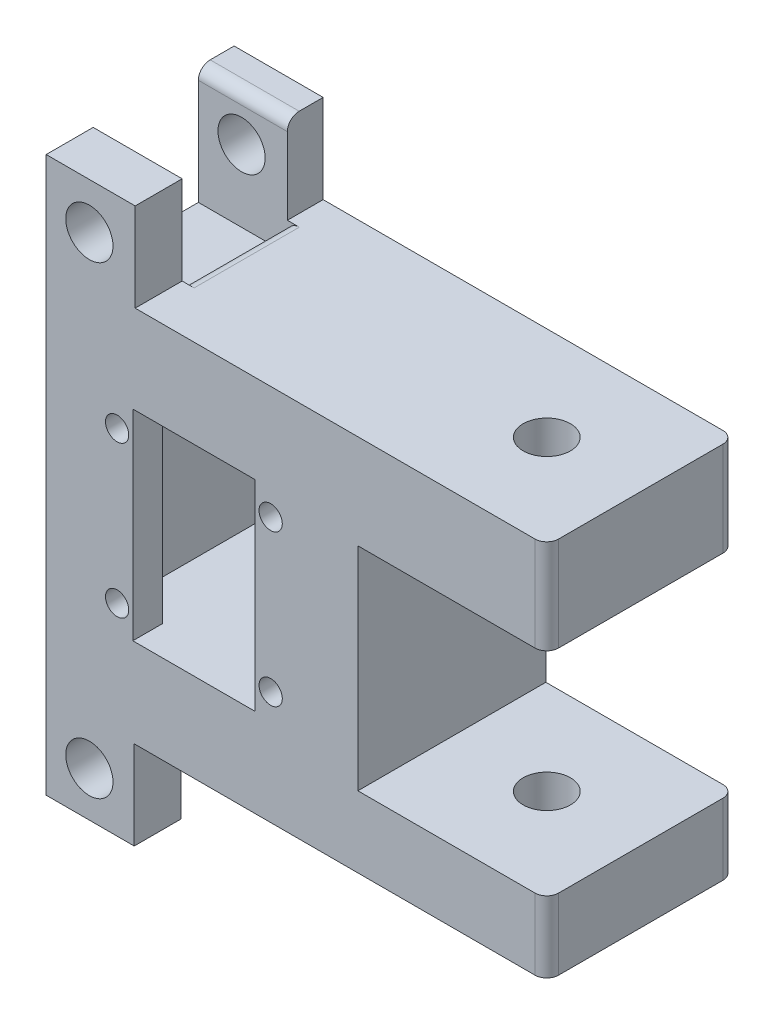
from build123d import *

# Parameters (mm, degrees)
BOSS_EXTRUDE1_DEPTH      = 55.88
BOSS_EXTRUDE1_DEPTH_BACK = 25.384918905
SKETCH1_W                = 107.698417182
SKETCH1_H                = 40.435670154
SKETCH7_W                = 43.633869471
SKETCH7_H                = 43.18
CUT_EXTRUDE8_DEPTH       = 88.506314553
SKETCH11_R               = 5.08
CUT_EXTRUDE9_DEPTH       = 100.561464261
FILLET2_R                = 2.54
SKETCH13_W               = 44.238094174
SKETCH13_H               = 45.644522424
CUT_EXTRUDE12_DEPTH      = 88.506314553
SKETCH16_W               = 19.145212778
SKETCH16_H               = 40.435670154
BOSS_EXTRUDE3_DEPTH      = 19.05
SKETCH17_W               = 18.93986558
SKETCH17_H               = 40.435670154
BOSS_EXTRUDE4_DEPTH      = 19.05
SKETCH18_R               = 5.08
CUT_EXTRUDE14_DEPTH      = 101.743662762
SKETCH19_W               = 12.523537134
SKETCH19_H               = 13.59850093
SKETCH19_W_2             = 10.108917538
SKETCH19_H_2             = 12.59254748
CUT_EXTRUDE15_DEPTH      = 19.05
SKETCH20_W               = 18.93986558
SKETCH20_H               = 22.510158117
CUT_EXTRUDE16_DEPTH      = 12.7
SKETCH23_W               = 22.632454672
SKETCH23_H               = 12.59254748
CUT_EXTRUDE19_DEPTH      = 12.7
SKETCH24_W               = 19.174620912
SKETCH24_H               = 22.632454672
CUT_EXTRUDE20_DEPTH      = 12.7
FILLET4_R                = 2.54
FILLET5_R                = 2.54
SKETCH25_W               = 8.617694519
SKETCH25_H               = 43.18
BOSS_EXTRUDE5_DEPTH      = 6.35
SKETCH26_W               = 8.674470407
SKETCH26_H               = 43.18
BOSS_EXTRUDE6_DEPTH      = 6.35
SKETCH27_R               = 2.5
CUT_EXTRUDE21_DEPTH      = 6.35
SKETCH22_W               = 22.632454672
SKETCH22_H               = 12.59254748
CUT_EXTRUDE18_DEPTH      = 12.7


with BuildPart() as part:
    # Sketch1 → Boss-Extrude1 (new, two sides: drawn at the far end of the back side and taken through both)
    with BuildSketch(Plane(origin=(0, 0, 0), x_dir=(1, 0, 0), z_dir=(0, 1, 0)).offset(-BOSS_EXTRUDE1_DEPTH_BACK)):
        Rectangle(SKETCH1_W, SKETCH1_H)
    extrude(amount=BOSS_EXTRUDE1_DEPTH + BOSS_EXTRUDE1_DEPTH_BACK)

    # Sketch7 → Cut-Extrude8 (cut, through all)
    with BuildSketch(Plane.XY.offset(20.217835077)):
        with Locations((-22.071539031, 15.247540547)):
            Rectangle(SKETCH7_W, SKETCH7_H)
    extrude(amount=-CUT_EXTRUDE8_DEPTH, mode=Mode.SUBTRACT)

    # Sketch11 → Cut-Extrude9 (cut, through all)
    with BuildSketch(Plane(origin=(0, -25.384918905, 0), x_dir=(-1, 0, 0), z_dir=(0, -1, 0))):
        with Locations(Location((-33.631373514, 0, 0), (0, 0, 90))):
            Circle(SKETCH11_R)
    extrude(amount=-CUT_EXTRUDE9_DEPTH, mode=Mode.SUBTRACT)

    # Fillet2
    fillet2_edges = [part.edges().sort_by_distance(p)[0] for p in [
        (53.849208591, 15.247540547, 20.217835077),
        (53.849208591, 15.247540547, -20.217835077),
    ]]
    fillet(fillet2_edges, radius=FILLET2_R)

    # Sketch13 → Cut-Extrude12 (cut, through all)
    with BuildSketch(Plane.XY.offset(20.217835077)):
        with Locations((35.328255678, 12.741509062)):
            Rectangle(SKETCH13_W, SKETCH13_H)
    extrude(amount=-CUT_EXTRUDE12_DEPTH, mode=Mode.SUBTRACT)

    # Sketch16 → Boss-Extrude3 (add)
    with BuildSketch(Plane(origin=(0, 55.88, 0), x_dir=(1, 0, 0), z_dir=(0, 1, 0))):
        with Locations((-44.276602202, 0)):
            Rectangle(SKETCH16_W, SKETCH16_H)
    extrude(amount=BOSS_EXTRUDE3_DEPTH)

    # Sketch17 → Boss-Extrude4 (add)
    with BuildSketch(Plane.XZ.offset(25.384918905)):
        with Locations((-44.379275801, 0)):
            Rectangle(SKETCH17_W, SKETCH17_H)
    extrude(amount=BOSS_EXTRUDE4_DEPTH)

    # Sketch18 → Cut-Extrude14 (cut, through all)
    with BuildSketch(Plane.XY.offset(20.217835077)):
        with Locations((-44.558869733, 65.07512608)):
            Circle(SKETCH18_R)
        with Locations((-44.558869733, -34.785392183)):
            Circle(SKETCH18_R)
    extrude(amount=-CUT_EXTRUDE14_DEPTH, mode=Mode.SUBTRACT)

    # Sketch19 → Cut-Extrude15 (cut)
    with BuildSketch(Plane.ZY.offset(53.849208591)):
        with Locations((-6.261768567, -37.63566844)):
            Rectangle(SKETCH19_W, SKETCH19_H)
        with Locations((5.054458769, -37.63566844)):
            Rectangle(SKETCH19_W_2, SKETCH19_H)
        with Locations((-6.261768567, 68.63372626)):
            Rectangle(SKETCH19_W, SKETCH19_H_2)
        with Locations((5.054458769, 68.63372626)):
            Rectangle(SKETCH19_W_2, SKETCH19_H_2)
    extrude(amount=-CUT_EXTRUDE15_DEPTH, mode=Mode.SUBTRACT)

    # Sketch20 → Cut-Extrude16 (cut)
    with BuildSketch(Plane(origin=(0, -30.836417975, 0), x_dir=(-1, 0, 0), z_dir=(0, -1, 0))):
        with Locations((44.379275801, 1.268458076)):
            Rectangle(SKETCH20_W, SKETCH20_H)
    extrude(amount=-CUT_EXTRUDE16_DEPTH, mode=Mode.SUBTRACT)

    # Sketch23 → Cut-Extrude19 (cut)
    with BuildSketch(Plane.ZY.offset(34.799208591)):
        with Locations((-1.207309798, 68.63372626)):
            Rectangle(SKETCH23_W, SKETCH23_H)
    extrude(amount=-CUT_EXTRUDE19_DEPTH, mode=Mode.SUBTRACT)

    # Sketch24 → Cut-Extrude20 (cut)
    with BuildSketch(Plane(origin=(0, 62.33745252, 0), x_dir=(1, 0, 0), z_dir=(0, 1, 0))):
        with Locations((-44.261898135, 1.207309798)):
            Rectangle(SKETCH24_W, SKETCH24_H)
    extrude(amount=-CUT_EXTRUDE20_DEPTH, mode=Mode.SUBTRACT)

    # Fillet4
    fillet4_edges = [part.edges().sort_by_distance(p)[0] for p in [
        (-44.276602202, 74.93, -12.523537134),
        (-0.254604295, 15.247540547, -20.217835077),
    ]]
    fillet(fillet4_edges, radius=FILLET4_R)

    # Fillet5
    fillet5_edges = [part.edges().sort_by_distance(p)[0] for p in [
        (-34.909343011, -25.384918905, -1.268458075),
        (-34.674587679, 55.88, -1.207309798),
    ]]
    fillet(fillet5_edges, radius=FILLET5_R)

    # Sketch25 → Boss-Extrude5 (add)
    with BuildSketch(Plane.XY.offset(20.217835077)):
        with Locations((-4.563451555, 15.247540547)):
            Rectangle(SKETCH25_W, SKETCH25_H)
    extrude(amount=-BOSS_EXTRUDE5_DEPTH)

    # Sketch26 → Boss-Extrude6 (add)
    with BuildSketch(Plane.XY.offset(20.217835077)):
        with Locations((-39.551238563, 15.247540547)):
            Rectangle(SKETCH26_W, SKETCH26_H)
    extrude(amount=-BOSS_EXTRUDE6_DEPTH)

    # Sketch27 → Cut-Extrude21 (cut)
    with BuildSketch(Plane(origin=(0, 0, 13.867835077), x_dir=(-1, 0, 0), z_dir=(0, 0, -1))):
        with Locations((5.557905154, -1.039158594)):
            Circle(SKETCH27_R)
        with Locations((5.557905154, 31.534239688)):
            Circle(SKETCH27_R)
        with Locations((38.585172907, -1.039158594)):
            Circle(SKETCH27_R)
        with Locations((38.585172907, 31.534239688)):
            Circle(SKETCH27_R)
    extrude(amount=-CUT_EXTRUDE21_DEPTH, mode=Mode.SUBTRACT)

    # Sketch22 → Cut-Extrude18 (cut)
    with BuildSketch(Plane.ZY.offset(34.799208591)):
        with Locations((-1.207309798, 68.63372626)):
            Rectangle(SKETCH22_W, SKETCH22_H)
    extrude(amount=-CUT_EXTRUDE18_DEPTH, mode=Mode.SUBTRACT)


solid = part.part
